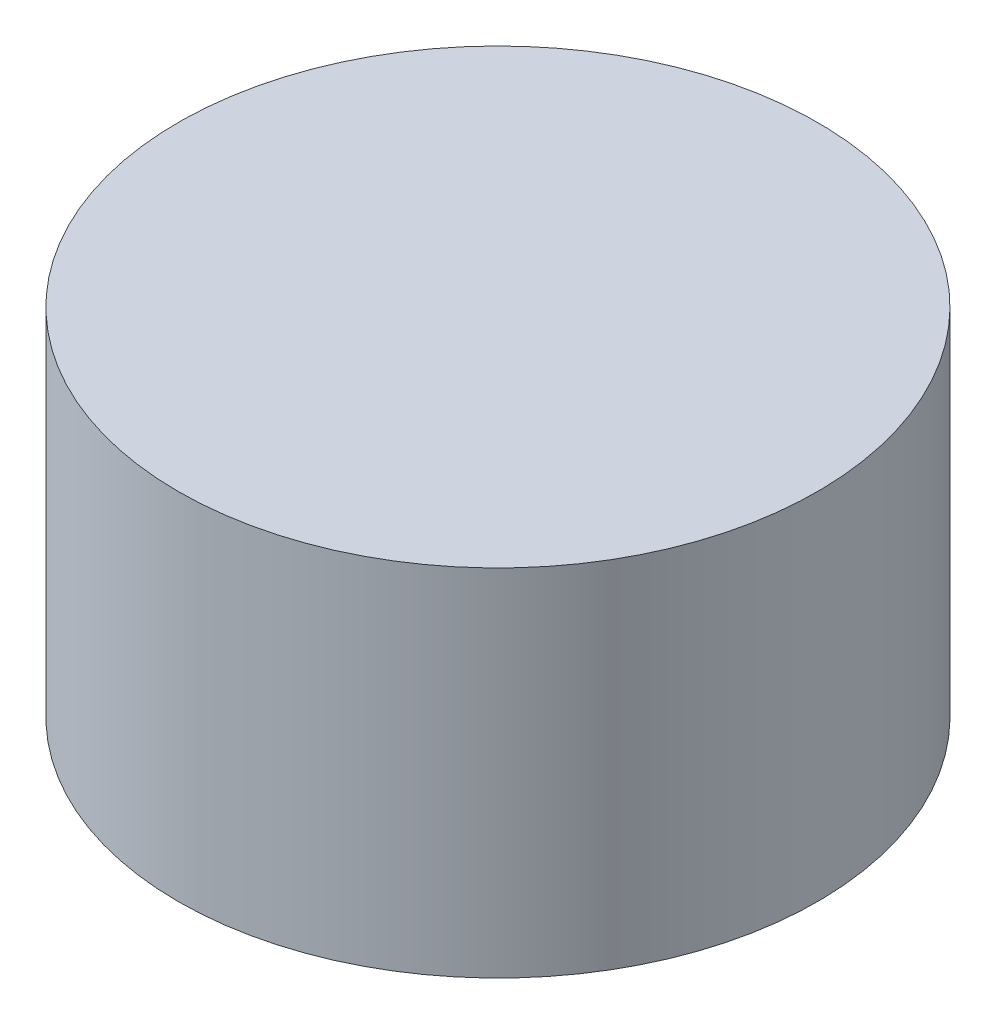
from build123d import *

# Parameters (mm, degrees)
SKETCH1_R           = 90
BOSS_EXTRUDE1_DEPTH = 100


with BuildPart() as part:
    # Sketch1 → Boss-Extrude1 (new body)
    with BuildSketch(Plane(origin=(0, 0, 0), x_dir=(1, 0, 0), z_dir=(0, 1, 0))):
        with Locations(Location((0, 0, 0), (0, 0, 270))):
            Circle(SKETCH1_R)
    extrude(amount=BOSS_EXTRUDE1_DEPTH)


solid = part.part
